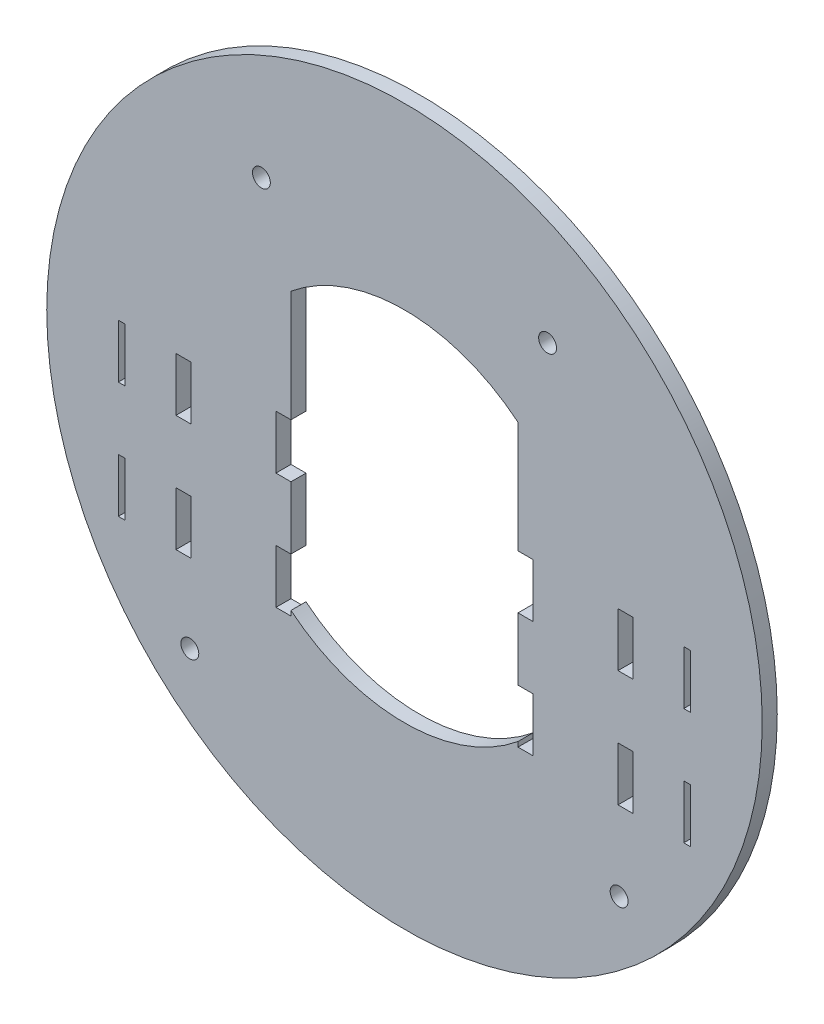
from build123d import *

# Parameters (mm, degrees)
SKETCH1_R           = 127
SKETCH1_R_2         = 63.5
BOSS_EXTRUDE1_DEPTH = 5.334
SKETCH14_R          = 3.175
BOLTHOLES_DEPTH     = 180.684310823
SKETCH15_W          = 2.4638
SKETCH15_H          = 19.05
SKETCH15_W_2        = 5.334
MOTORMOUNTS_DEPTH   = 180.684310823


with BuildPart() as part:
    # Sketch1 → Boss-Extrude1 (new body)
    # profile 1 of 3: a face of its own
    with BuildSketch(Plane.XY):
        Circle(SKETCH1_R)
        Circle(SKETCH1_R_2, mode=Mode.SUBTRACT)
    # profile 2 of 3: a face of its own
    with BuildSketch(Plane.XY):
        with BuildLine():
            Line((-40.299999918, -49.073006904), (-40.299999918, 49.073006904))
            ThreePointArc((-40.299999918, 49.073006904), (-63.5, 0), (-40.299999918, -49.073006904))
        make_face()
    # profile 3 of 3: a face of its own
    with BuildSketch(Plane.XY):
        with BuildLine():
            ThreePointArc((63.5, 0), (57.407752067, 27.140375874), (40.299999918, 49.073006904))
            Line((40.299999918, 49.073006904), (40.299999918, -49.073006904))
            ThreePointArc((40.299999918, -49.073006904), (57.407752067, -27.140375874), (63.5, 0))
        make_face()
    extrude(amount=BOSS_EXTRUDE1_DEPTH)

    # Sketch14 → BoltHoles (cut, through all)
    with BuildSketch(Plane.XY.offset(5.334)):
        with Locations((-76.2, -78.74)):
            Circle(SKETCH14_R)
        with Locations((-50.8, 78.74)):
            Circle(SKETCH14_R)
        with Locations(Location((76.2, -78.74, 0), (0, 0, 180))):
            Circle(SKETCH14_R)
        with Locations(Location((50.8, 78.74, 0), (0, 0, 180))):
            Circle(SKETCH14_R)
    extrude(amount=-BOLTHOLES_DEPTH, mode=Mode.SUBTRACT)

    # Sketch15 → MotorMounts (cut, through all)
    with BuildSketch(Plane.XY.offset(5.334)):
        with Locations((-100.3681, -41.275)):
            Rectangle(SKETCH15_W, SKETCH15_H)
        with Locations((-100.3681, 0)):
            Rectangle(SKETCH15_W, SKETCH15_H)
        with Locations((-78.469199932, -41.275)):
            Rectangle(SKETCH15_W_2, SKETCH15_H)
        with Locations((-42.966999918, -41.275)):
            Rectangle(SKETCH15_W_2, SKETCH15_H)
        with Locations((-78.469199932, 0)):
            Rectangle(SKETCH15_W_2, SKETCH15_H)
        with Locations((42.966999918, 0)):
            Rectangle(SKETCH15_W_2, SKETCH15_H)
        with Locations((42.966999918, -41.275)):
            Rectangle(SKETCH15_W_2, SKETCH15_H)
        with Locations((78.469199932, 0)):
            Rectangle(SKETCH15_W_2, SKETCH15_H)
        with Locations((100.3681, 0)):
            Rectangle(SKETCH15_W, SKETCH15_H)
        with Locations((-42.966999918, 0)):
            Rectangle(SKETCH15_W_2, SKETCH15_H)
        with Locations((78.469199932, -41.275)):
            Rectangle(SKETCH15_W_2, SKETCH15_H)
        with Locations((100.3681, -41.275)):
            Rectangle(SKETCH15_W, SKETCH15_H)
    extrude(amount=-MOTORMOUNTS_DEPTH, mode=Mode.SUBTRACT)


solid = part.part
